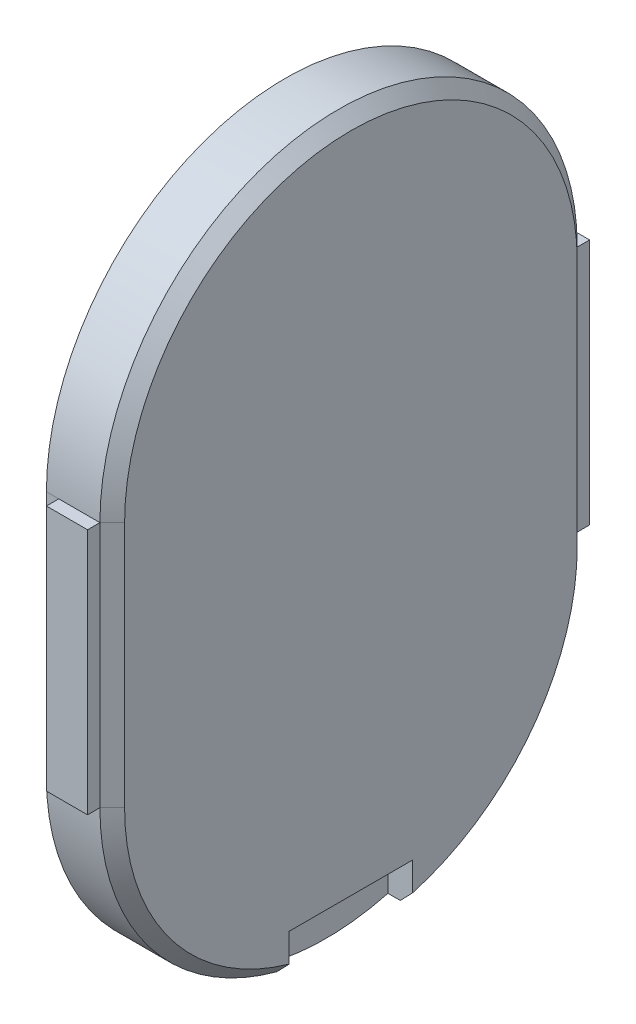
from build123d import *

# Parameters (mm, degrees)
BOSS_EXTRUDE1_START = 61.4
BOSS_EXTRUDE1_DEPTH = 1.6
CHAMFER1_SIZE       = 0.3
BOSS_EXTRUDE2_START = 61.3
SKETCH2_W           = 1
SKETCH2_H           = 6
BOSS_EXTRUDE2_DEPTH = 0.31
BOSS_EXTRUDE3_START = 73.19
SKETCH3_W           = 1
SKETCH3_H           = 6
BOSS_EXTRUDE3_DEPTH = 0.31
BOSS_EXTRUDE4_START = 65.9
SKETCH4_W           = 0.7
SKETCH4_H           = 1.3
BOSS_EXTRUDE4_DEPTH = 3


with BuildPart() as part:
    # Sketch1 → Boss-Extrude1 (new body)
    with BuildSketch(Plane(origin=(0, 0, 0), x_dir=(0, 0, -1), z_dir=(1, 0, 0)).offset(BOSS_EXTRUDE1_START)):
        with BuildLine():
            Line((-73.2, 110), (-73.2, 116))
            ThreePointArc((-73.2, 116), (-71.501219331, 120.101219331), (-67.4, 121.8))
            ThreePointArc((-67.4, 121.8), (-63.298780669, 120.101219331), (-61.6, 116))
            Line((-61.6, 116), (-61.6, 110))
            ThreePointArc((-61.6, 110), (-63.298780669, 105.898780669), (-67.4, 104.2))
            ThreePointArc((-67.4, 104.2), (-71.501219331, 105.898780669), (-73.2, 110))
        make_face()
    extrude(amount=BOSS_EXTRUDE1_DEPTH)

    # Chamfer1
    chamfer1_edges = [part.edges().sort_by_distance(p)[0] for p in [
        (63, 104.2, 67.4),
        (63, 113, 61.6),
        (63, 113, 73.2),
        (63, 121.8, 67.4),
    ]]
    chamfer(chamfer1_edges, length=CHAMFER1_SIZE)

    # Sketch2 → Boss-Extrude2 (add)
    with BuildSketch(Plane.XY.offset(BOSS_EXTRUDE2_START)):
        with Locations((62.2, 113)):
            Rectangle(SKETCH2_W, SKETCH2_H)
    extrude(amount=BOSS_EXTRUDE2_DEPTH)

    # Sketch3 → Boss-Extrude3 (add)
    with BuildSketch(Plane.XY.offset(BOSS_EXTRUDE3_START)):
        with Locations((62.2, 113)):
            Rectangle(SKETCH3_W, SKETCH3_H)
    extrude(amount=BOSS_EXTRUDE3_DEPTH)


with BuildPart() as body_2:
    # Sketch4 → Boss-Extrude4 (new body)
    with BuildSketch(Plane.XY.offset(BOSS_EXTRUDE4_START)):
        with Locations((62.75, 104.75)):
            Rectangle(SKETCH4_W, SKETCH4_H)
    extrude(amount=BOSS_EXTRUDE4_DEPTH)


with BuildPart() as part_1:
    add(part.part)

    # Combine1: cut body 2
    add(body_2.part, mode=Mode.SUBTRACT)


solid = part_1.part
